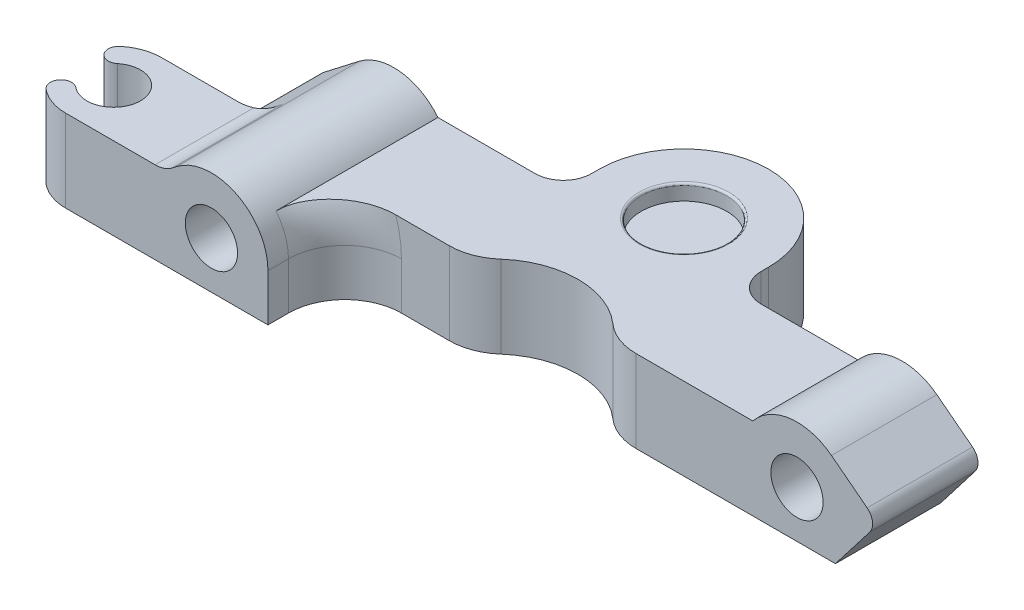
from build123d import *

# Parameters (mm, degrees)
SKETCH3_W           = 41.4470817463862
SKETCH3_H           = 7.459999999999999
BOSS_EXTRUDE1_DEPTH = 5.825
BOSS_EXTRUDE3_DEPTH = 7.46
BOSS_EXTRUDE4_DEPTH = 5.825
SKETCH7_R           = 3.0300000000000007
CUT_EXTRUDE1_DEPTH  = 1.1
FILLET1_R           = 0.15
SKETCH8_R           = 1.8500000000000012
CUT_EXTRUDE2_DEPTH  = 26.910016764772163
FILLET2_R           = 1
FILLET3_R           = 2
SKETCH10_R          = 1.8500000000000012
BOSS_EXTRUDE5_DEPTH = 5.45
BOSS_EXTRUDE6_REACH = 30.603
SKETCH11_R          = 6
CUT_EXTRUDE3_DEPTH  = 35.90405396884001
FILLET4_R           = 1
FILLET5_R           = 2
FILLET6_R           = 4


with BuildPart() as part:
    # Sketch3 → Boss-Extrude1 (new body)
    with BuildSketch(Plane(origin=(0, 0, 0), x_dir=(1, 0, 0), z_dir=(0, 1, 0))):
        with Locations((7.11e-15, -6.269999999999988)):
            Rectangle(SKETCH3_W, SKETCH3_H)
    extrude(amount=-BOSS_EXTRUDE1_DEPTH)

    # Sketch4 → Boss-Extrude3 (add)
    with BuildSketch(Plane.XY.offset(2.5400000000000014)):
        with BuildLine():
            Line((20.72354087319311, 1e-17), (14.877501000800818, -2.18e-15))
            ThreePointArc((14.877501000800818, -2.18e-15), (17.523673872635282, 1.4715379162724416), (20.442771335934772, 0.6674703156202451))
            Line((20.442771335934772, 0.6674703156202451), (23.75850887052414, -1.8896455528490175))
            Line((23.75850887052414, -1.8896455528490175), (20.72354087319311, -5.825000000000009))
            Line((20.72354087319311, -5.825000000000009), (20.72354087319311, 1e-17))
        make_face()
        with BuildLine():
            Line((-20.723540873193116, -1.342e-14), (-20.72354087319311, -5.825000000000023))
            Line((-20.72354087319311, -5.825000000000023), (-23.75850887052414, -1.8896455528490332))
            Line((-23.75850887052414, -1.8896455528490332), (-20.442771335934772, 0.6674703156202321))
            ThreePointArc((-20.442771335934772, 0.6674703156202321), (-17.523673872635282, 1.4715379162724296), (-14.877501000800818, -1.085e-14))
            Line((-14.877501000800818, -1.085e-14), (-20.723540873193116, -1.342e-14))
        make_face()
    extrude(amount=BOSS_EXTRUDE3_DEPTH)

    # Sketch6 → Boss-Extrude4 (add)
    with BuildSketch(Plane(origin=(0, 0, 0), x_dir=(1, 0, 0), z_dir=(0, 1, 0))):
        with BuildLine():
            Line((6.000000000000012, 0), (6.000000000000012, -2.539999999999988))
            Line((6.000000000000012, -2.539999999999988), (-6.000000000000012, -2.5399999999999876))
            Line((-6.000000000000012, -2.5399999999999876), (-6.000000000000012, 0))
            ThreePointArc((-6.000000000000012, 0), (3.7e-16, 6.000000000000012), (6.000000000000012, 0))
        make_face()
    extrude(amount=-BOSS_EXTRUDE4_DEPTH)

    # Sketch7 → Cut-Extrude1 (cut)
    with BuildSketch(Plane(origin=(0, 0, 0), x_dir=(1, 0, 0), z_dir=(0, 1, 0))):
        with Locations(Location((-3.23e-15, 1.128e-14, 0), (0, 0, 270))):
            Circle(SKETCH7_R)
    extrude(amount=-CUT_EXTRUDE1_DEPTH, mode=Mode.SUBTRACT)

    # Fillet1
    fillet1_edges = [part.edges().sort_by_distance(p)[0] for p in [
        (-3.65e-15, 0, -3.030000000000012),
    ]]
    fillet(fillet1_edges, radius=FILLET1_R)

    # Sketch8 → Cut-Extrude2 (cut, through all)
    with BuildSketch(Plane(origin=(0, 0, 2.5399999999999885), x_dir=(-1, 0, 0), z_dir=(0, 0, -1))):
        with Locations((-18.000000000000007, -2.500000000000002)):
            Circle(SKETCH8_R)
        with Locations((18, -2.500000000000002)):
            Circle(SKETCH8_R)
    extrude(amount=-CUT_EXTRUDE2_DEPTH, mode=Mode.SUBTRACT)

    # Fillet2
    fillet2_edges = [part.edges().sort_by_distance(p)[0] for p in [
        (23.75850887052414, -1.8896455528490175, 6.270000000000001),
        (-23.75850887052414, -1.8896455528490332, 6.270000000000001),
    ]]
    fillet(fillet2_edges, radius=FILLET2_R)

    # Fillet3
    fillet3_edges = [part.edges().sort_by_distance(p)[0] for p in [
        (6.000000000000012, -2.9125, 2.539999999999988),
        (-6.000000000000012, -2.9125, 2.5399999999999876),
    ]]
    fillet(fillet3_edges, radius=FILLET3_R)

    # Sketch10 → Boss-Extrude5 (add)
    with BuildSketch(Plane.XY.offset(9.999999999999988)):
        with BuildLine():
            Line((-14.000000000000012, -2.500000000000014), (-14.000000000000012, -5.825000000000023))
            Line((-14.000000000000012, -5.825000000000023), (-20.72354087319311, -5.825000000000023))
            Line((-20.72354087319311, -5.825000000000023), (-23.147816036529186, -2.681513131755552))
            ThreePointArc((-23.147816036529186, -2.681513131755552), (-23.347708436606982, -1.9427104070558383), (-22.966641291612717, -1.2789527188604377))
            Line((-22.966641291612717, -1.2789527188604377), (-20.442771335934772, 0.6674703156202321))
            ThreePointArc((-20.442771335934772, 0.6674703156202321), (-16.235217484183835, 1.0896438084954059), (-14.000000000000012, -2.500000000000014))
        make_face()
        with Locations(Location((-18, -2.500000000000002, 0), (0, 0, 180))):
            Circle(SKETCH10_R, mode=Mode.SUBTRACT)
    extrude(amount=BOSS_EXTRUDE5_DEPTH)

    # Boss-Extrude6: up to this face of the body (flat: up to its plane)
    boss_extrude6_end = Plane(part.part.faces().sort_by_distance((-1.463911486, -5.825, 5.299880687))[0])
    # Sketch9 → Boss-Extrude6 (add, up to the picked face)
    with BuildSketch(Plane(origin=(0, 0, 0), x_dir=(1, 0, 0), z_dir=(0, 1, 0)), mode=Mode.PRIVATE) as boss_extrude6_sk1:
        with BuildLine():
            Line((-20.723540873193105, -8.650000000000004), (-28.322297461263148, -8.650000000000004))
            ThreePointArc((-28.322297461263148, -8.650000000000004), (-29.466272655610958, -8.848231620695078), (-30.476852522423187, -9.41981132075475))
            ThreePointArc((-30.476852522423187, -9.41981132075475), (-30.58177170288316, -10.475269498785284), (-29.5263135248526, -10.580188679245284))
            ThreePointArc((-29.5263135248526, -10.580188679245284), (-26.4222974612631, -12.050000000000004), (-29.5263135248526, -13.519811320754725))
            ThreePointArc((-29.5263135248526, -13.519811320754725), (-30.581771702883188, -13.624730501214703), (-30.476852522423194, -14.680188679245271))
            ThreePointArc((-30.476852522423194, -14.680188679245271), (-29.466272655610975, -15.251768379304975), (-28.322297461263148, -15.450000000000019))
            Line((-28.322297461263148, -15.450000000000019), (-20.723540873193105, -15.450000000000003))
            Line((-20.723540873193105, -15.450000000000003), (-20.723540873193105, -8.650000000000004))
        make_face()
    boss_extrude6_tool1 = split(extrude(boss_extrude6_sk1.sketch, amount=-BOSS_EXTRUDE6_REACH, mode=Mode.PRIVATE), bisect_by=boss_extrude6_end, keep=Keep.BOTH, mode=Mode.PRIVATE)
    add(boss_extrude6_tool1.solids().sort_by(Axis((-24.875622, 0, 12.05), (0, -1, 0)))[0])

    # Sketch11 → Cut-Extrude3 (cut, through all)
    with BuildSketch(Plane(origin=(0, 0, 0), x_dir=(1, 0, 0), z_dir=(0, 1, 0))):
        with Locations((1.06e-15, -13.500000000000007)):
            Circle(SKETCH11_R)
    extrude(amount=-CUT_EXTRUDE3_DEPTH, mode=Mode.SUBTRACT)

    # Fillet4
    fillet4_edges = [part.edges().sort_by_distance(p)[0] for p in [
        (-23.34770843660698, -1.9427104070558383, 8.650000000000004),
        (-22.137450955112786, -0.6394763594302192, 8.650000000000004),
        (-21.935678454861147, -4.253256565877788, 8.650000000000006),
    ]]
    fillet(fillet4_edges, radius=FILLET4_R)

    # Fillet5
    fillet5_edges = [part.edges().sort_by_distance(p)[0] for p in [
        (-21.30826061861286, -1.1e-16, 11.55),
    ]]
    fillet(fillet5_edges, radius=FILLET5_R)

    # Fillet6
    fillet6_edges = [part.edges().sort_by_distance(p)[0] for p in [
        (-14.225745371812032, -1.1752351145952094, 9.999999999999988),
        (-14.000000000000012, -4.162500000000019, 9.999999999999988),
        (4.873397172404469, -2.9125, 9.999999999999988),
        (-4.873397172404467, -2.9125, 9.999999999999988),
    ]]
    fillet(fillet6_edges, radius=FILLET6_R)


solid = part.part
